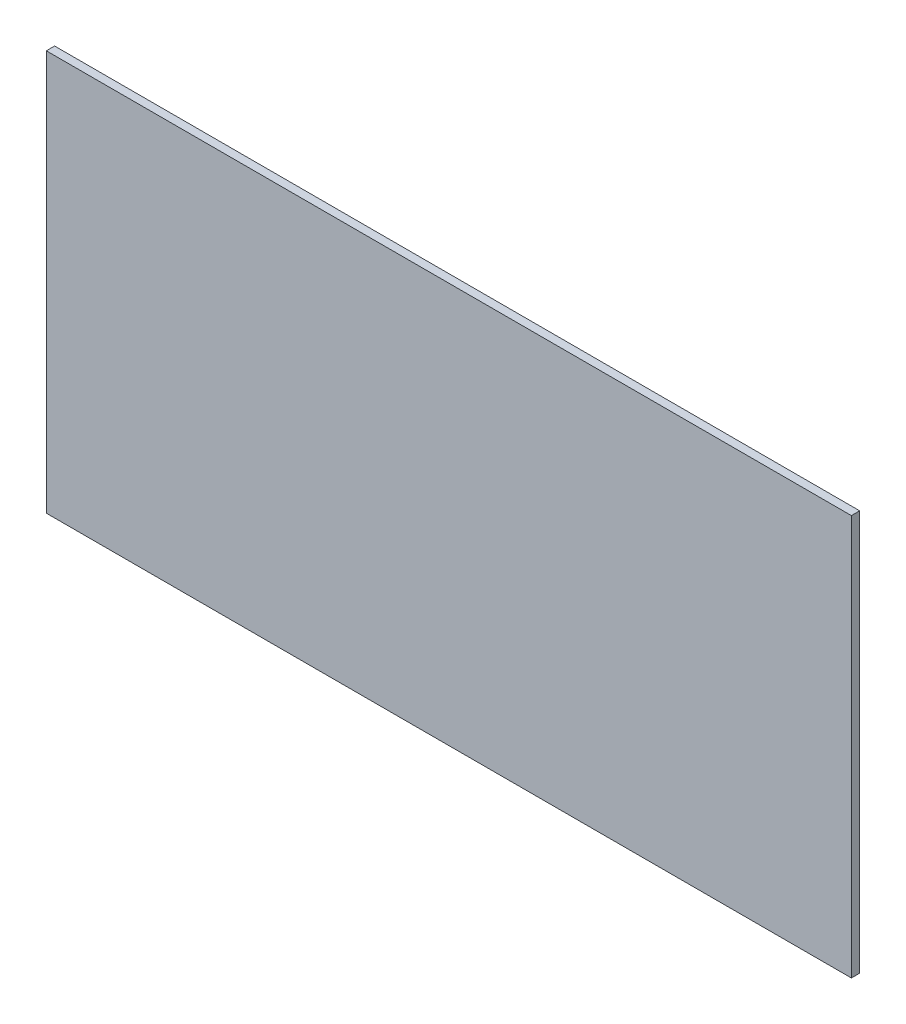
from build123d import *

# Parameters (mm, degrees)
SKICA1_W                = 388
SKICA1_H                = 193
P_IDAT_VYSUNUT_M1_DEPTH = 4


with BuildPart() as part:
    # Skica1 → Přidat vysunutím1 (new body)
    with BuildSketch(Plane.XY):
        Rectangle(SKICA1_W, SKICA1_H)
    extrude(amount=P_IDAT_VYSUNUT_M1_DEPTH)


solid = part.part
